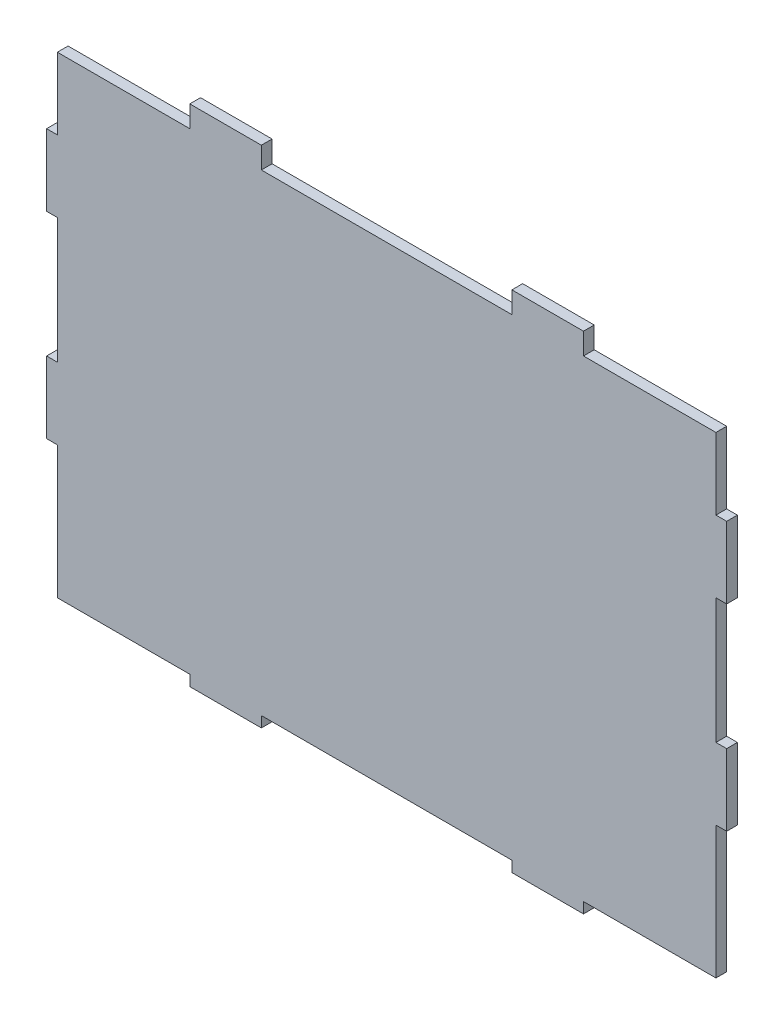
from build123d import *

# Parameters (mm, degrees)
EXTRUDE_1_DEPTH = 3


with BuildPart() as part:
    # Эскиз2 → Бобышка-Вытянуть1 (new body)
    with BuildSketch(Plane.XY):
        Polygon((0, 112), (0, 132), (37, 132), (37, 138), (57, 138), (57, 132), (127, 132), (127, 138), (147, 138), (147, 132), (184, 132), (184, 112), (187, 112), (187, 92), (184, 92), (184, 57), (187, 57), (187, 37), (184, 37), (184, 0), (147, 0), (147, -3), (127, -3), (127, 0), (57, 0), (57, -3), (37, -3), (37, 0), (0, 0), (0, 37), (-3, 37), (-3, 57), (0, 57), (0, 92), (-3, 92), (-3, 112), align=None)
    extrude(amount=EXTRUDE_1_DEPTH)


solid = part.part
